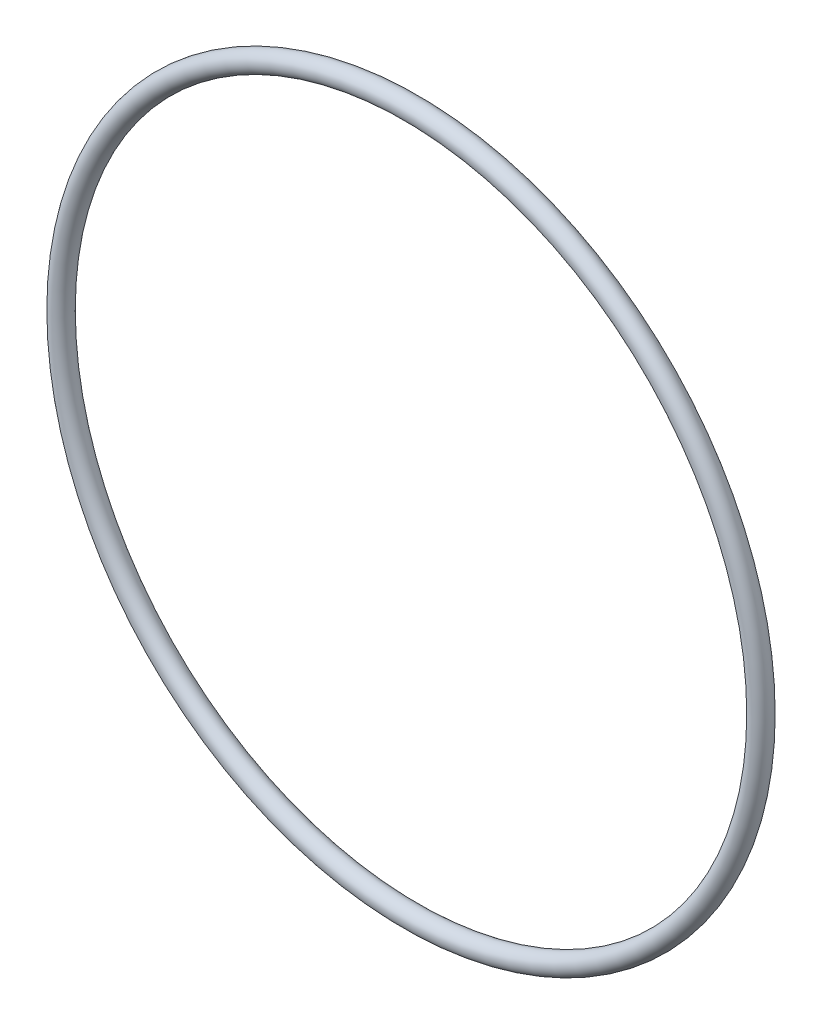
from build123d import *

# Parameters (mm, degrees)
SKETCH1_R = 0.889


with BuildPart() as part:
    # Sketch1 → Revolve1 (revolve)
    with BuildSketch(Plane(origin=(0, 0, 0), x_dir=(0, -1, 0), z_dir=(1, 0, 0)), mode=Mode.PRIVATE) as revolve1_sk:
        with Locations((30.9118, 0)):
            Circle(SKETCH1_R)
    revolve(revolve1_sk.sketch.rotate(Axis((0, 0, 0.889), (0, 0, -1)), 270), axis=Axis((0, 0, 0.889), (0, 0, -1)))


solid = part.part
